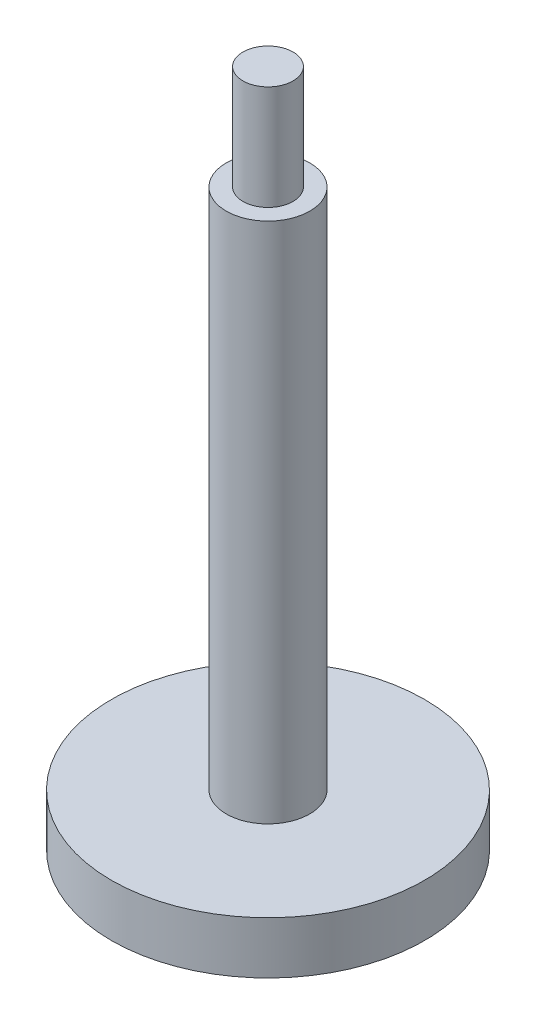
from build123d import *

# Parameters (mm, degrees)
CROQUIS2_R            = 1.35
CORTAR_EXTRUIR1_DEPTH = 20


with BuildPart() as part:
    # Croquis1 → Revolución1 (revolve)
    with BuildSketch(Plane(origin=(0, 0, 0), x_dir=(0, 0, -1), z_dir=(1, 0, 0)), mode=Mode.PRIVATE) as revoluci_n1_sk:
        Polygon((0, 0), (-2.4, 0), (-2.4, -10), (-4, -10), (-4, -60), (-15, -60), (-15, -65), (0, -65), align=None)
    revolve(revoluci_n1_sk.sketch.rotate(Axis((0, -65, 0), (0, 1, 0)), 180), axis=Axis((0, -65, 0), (0, 1, 0)))

    # Croquis2 → Cortar-Extruir1 (cut)
    with BuildSketch(Plane.XZ.offset(65)):
        with Locations(Location((0, 0, 0), (0, 0, 270))):
            Circle(CROQUIS2_R)
    extrude(amount=-CORTAR_EXTRUIR1_DEPTH, mode=Mode.SUBTRACT)


solid = part.part
